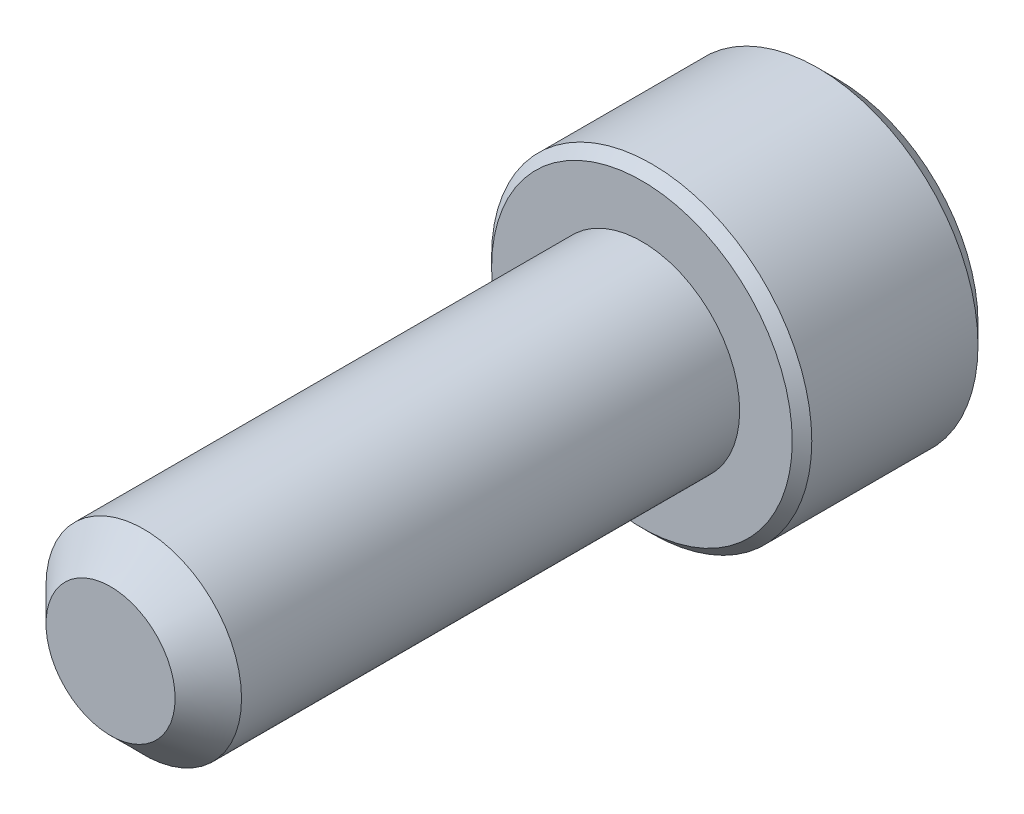
from build123d import *

# Parameters (mm, degrees)
SKETCH1_R          = 1.7526
EXTRUDE1_DEPTH     = 9.525
CHAMFER3_SIZE      = 0.5953125
SKETCH6_R          = 2.8702
EXTRUDE2_DEPTH     = 3.5052
CUT_EXTRUDE1_DEPTH = 2.08359375
SKETCH8_R          = 1.603951217
CUT_EXTRUDE2_DEPTH = 0.35052
CUT_EXTRUDE2_DRAFT = -45
CHAMFER1_SIZE      = 0.35052
CHAMFER2_SIZE      = 0.17526


with BuildPart() as part:
    # Sketch1 → Extrude1 (new body)
    with BuildSketch(Plane.XY):
        Circle(SKETCH1_R)
    extrude(amount=-EXTRUDE1_DEPTH)

    # Chamfer3
    chamfer3_edges = [part.edges().sort_by_distance(p)[0] for p in [
        (-1.7526, 0, 0),
    ]]
    chamfer(chamfer3_edges, length=CHAMFER3_SIZE)

    # Sketch6 → Extrude2 (add)
    with BuildSketch(Plane(origin=(0, 0, -9.525), x_dir=(-1, 0, 0), z_dir=(0, 0, -1))):
        Circle(SKETCH6_R)
    extrude(amount=EXTRUDE2_DEPTH)

    # Sketch7 → Cut-Extrude1 (cut)
    with BuildSketch(Plane(origin=(0, 0, -13.0302), x_dir=(-1, 0, 0), z_dir=(0, 0, -1))):
        Polygon((0, 1.603951217), (-1.3890625, 0.801975608), (-1.3890625, -0.801975608), (0, -1.603951217), (1.3890625, -0.801975608), (1.3890625, 0.801975608), align=None)
    extrude(amount=-CUT_EXTRUDE1_DEPTH, mode=Mode.SUBTRACT)


with BuildPart() as cut_extrude2_tool:
    # Sketch8 → Cut-Extrude2 (with draft: the straight prism first)
    with BuildSketch(Plane(origin=(0, 0, -13.0302), x_dir=(-1, 0, 0), z_dir=(0, 0, -1))):
        Circle(SKETCH8_R)
    extrude(amount=-CUT_EXTRUDE2_DEPTH)
    # Cut-Extrude2: the draft: its side faces are tilted about the plane it starts from
    cut_extrude2_sides = [cut_extrude2_tool.faces().sort_by_distance(p)[0] for p in [
        (1.603951217, 0, -12.85494),
    ]]
    draft(cut_extrude2_sides, Plane(origin=(0, 0, -13.0302), x_dir=(-1, 0, 0), z_dir=(0, 0, -1)), CUT_EXTRUDE2_DRAFT)


with BuildPart() as part_1:
    add(part.part)

    # Cut-Extrude2: cut by cut_extrude2_tool
    add(cut_extrude2_tool.part, mode=Mode.SUBTRACT)

    # Chamfer1
    chamfer1_edges = [part_1.edges().sort_by_distance(p)[0] for p in [
        (2.8702, 0, -13.0302),
    ]]
    chamfer(chamfer1_edges, length=CHAMFER1_SIZE)

    # Chamfer2
    chamfer2_edges = [part_1.edges().sort_by_distance(p)[0] for p in [
        (2.8702, 0, -9.525),
    ]]
    chamfer(chamfer2_edges, length=CHAMFER2_SIZE)


solid = part_1.part
